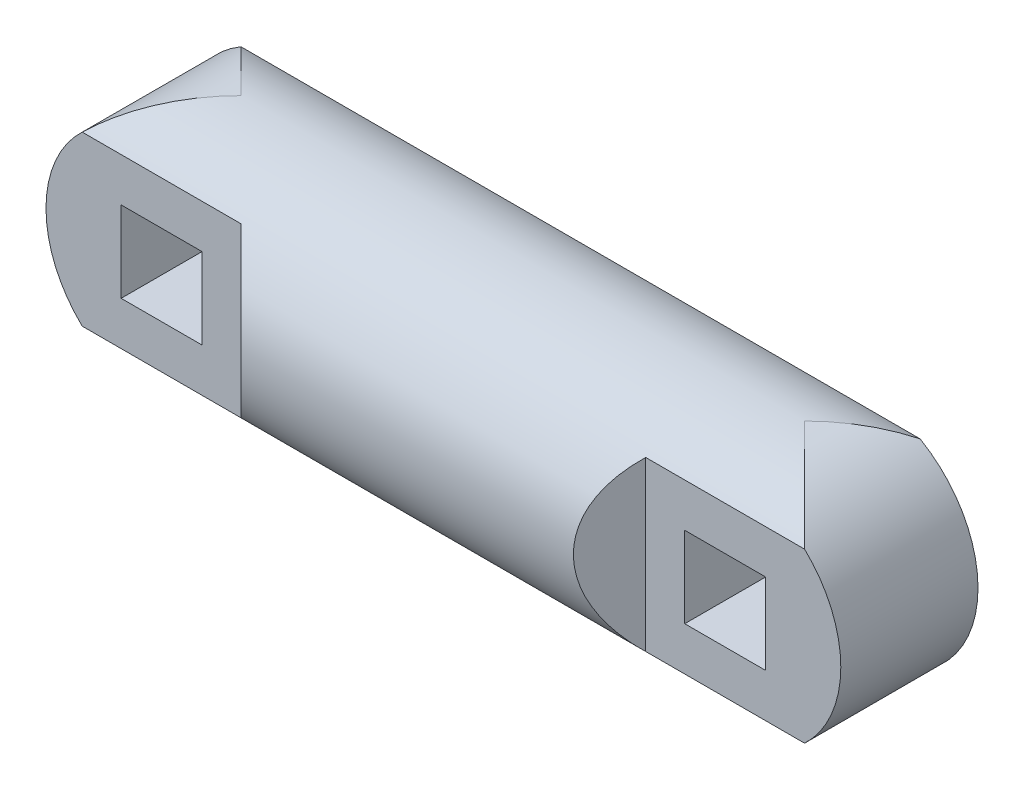
from build123d import *

# Parameters (mm, degrees)
RESSALTO_EXTRUS_O1_DEPTH      = 13.75
RESSALTO_EXTRUS_O1_DEPTH_BACK = 13.75
CORTE_EXTRUS_O1_DEPTH         = 13.75
CORTE_EXTRUS_O1_DEPTH_BACK    = 13.75
ESBO_O1_W                     = 2.8
ESBO_O1_H                     = 2.8
CORTE_EXTRUS_O2_DEPTH         = 13.75
CORTE_EXTRUS_O2_DEPTH_BACK    = 13.75


with BuildPart() as part:
    # Esboço2 → Ressalto-extrusão1 (new, two sides: drawn at the far end of the back side and taken through both)
    with BuildSketch(Plane(origin=(0, 0, 0), x_dir=(0, 0, -1), z_dir=(1, 0, 0)).offset(-RESSALTO_EXTRUS_O1_DEPTH_BACK)):
        with BuildLine():
            Line((2, 3.464101615), (2, -3.464101615))
            ThreePointArc((2, -3.464101615), (-4, 0), (2, 3.464101615))
        make_face()
    extrude(amount=RESSALTO_EXTRUS_O1_DEPTH + RESSALTO_EXTRUS_O1_DEPTH_BACK)

    # Esboço1 → Corte-extrusão1 (cut, two sides: drawn at the far end of the back side and taken through both)
    with BuildSketch(Plane.XY.offset(-CORTE_EXTRUS_O1_DEPTH_BACK)):
        with Locations((9.75, 0)):
            Rectangle(ESBO_O1_W, ESBO_O1_H)
        with BuildLine():
            Line((9.75, 4), (9.75, 5))
            Line((9.75, 5), (14.75, 5))
            Line((14.75, 5), (14.75, -5))
            Line((14.75, -5), (9.75, -5))
            Line((9.75, -5), (9.75, -4))
            ThreePointArc((9.75, -4), (13.75, 0), (9.75, 4))
        make_face()
        with BuildLine():
            Line((-9.75, -4), (-9.75, -5))
            Line((-9.75, -5), (-14.75, -5))
            Line((-14.75, -5), (-14.75, 5))
            Line((-14.75, 5), (-9.75, 5))
            Line((-9.75, 5), (-9.75, 4))
            ThreePointArc((-9.75, 4), (-13.75, 0), (-9.75, -4))
        make_face()
        with Locations((-9.75, 0)):
            Rectangle(ESBO_O1_W, ESBO_O1_H)
    extrude(amount=CORTE_EXTRUS_O1_DEPTH + CORTE_EXTRUS_O1_DEPTH_BACK, mode=Mode.SUBTRACT)

    # Esboço3 → Corte-extrusão2 (cut, two sides: drawn at the far end of the back side and taken through both)
    with BuildSketch(Plane(origin=(0, 0, 0), x_dir=(1, 0, 0), z_dir=(0, 1, 0)).offset(-CORTE_EXTRUS_O2_DEPTH_BACK)):
        Polygon((-7, -2.746998799), (-5.75, -4), (-5.75, -4.746998799), (-13.75, -4.746998799), (-13.75, -2.746998799), align=None)
        Polygon((13.75, -4.746998799), (13.75, -2.746998799), (7, -2.746998799), (5.75, -4), (5.75, -4.746998799), align=None)
    extrude(amount=CORTE_EXTRUS_O2_DEPTH + CORTE_EXTRUS_O2_DEPTH_BACK, mode=Mode.SUBTRACT)


solid = part.part
